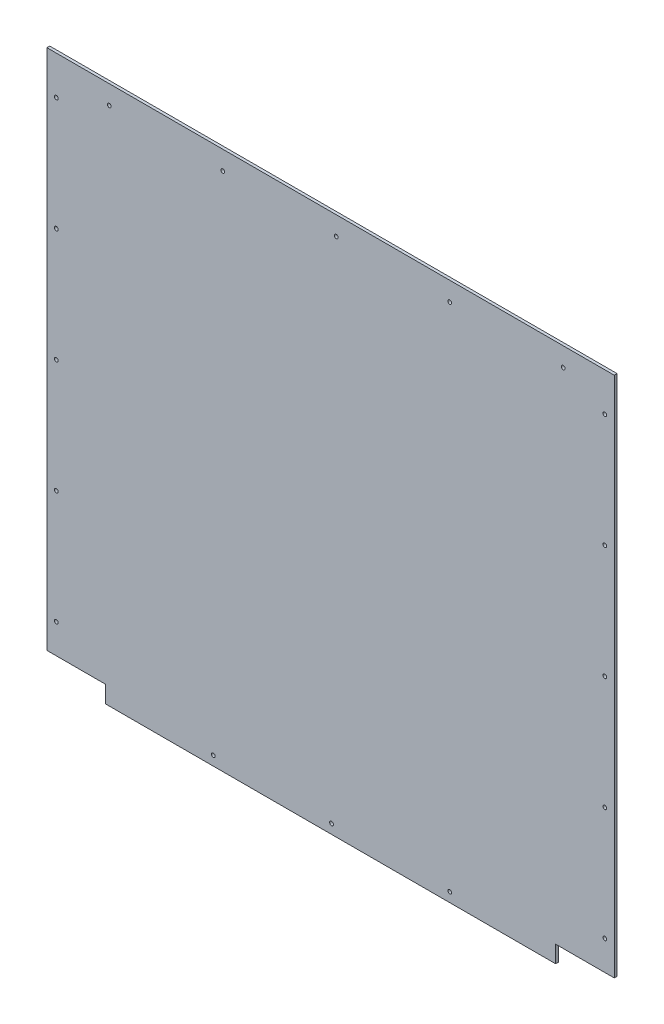
from build123d import *

# Parameters (mm, degrees)
SKETCH1_W             = 600
SKETCH1_H             = 570
BOSS_EXTRUDE1_DEPTH   = 3
SKETCH2_W             = 62
SKETCH2_H             = 18
CUT_EXTRUDE1_DEPTH    = 3
F_4_0MM_DOWEL_HOLE1_D = 4


with BuildPart() as part:
    # Sketch1 → Boss-Extrude1 (new body)
    with BuildSketch(Plane.XY):
        with Locations((300, 285)):
            Rectangle(SKETCH1_W, SKETCH1_H)
    extrude(amount=BOSS_EXTRUDE1_DEPTH)

    # Sketch2 → Cut-Extrude1 (cut)
    with BuildSketch(Plane.XY.offset(3)):
        with Locations((31, 9)):
            Rectangle(SKETCH2_W, SKETCH2_H)
        with Locations((569, 9)):
            Rectangle(SKETCH2_W, SKETCH2_H)
    extrude(amount=-CUT_EXTRUDE1_DEPTH, mode=Mode.SUBTRACT)

    # Ø4.0mm Dowel Hole1 (through all)
    with Locations(Plane(origin=(0, 0, 0), x_dir=(-1, 0, 0), z_dir=(0, 0, -1))):
        with Locations((-546, 550), (-590, 529.25), (-426, 10), (-426, 550), (-306, 550), (-186, 550), (-66, 550), (-10, 529.25), (-10, 409.25), (-10, 289.25), (-10, 169.25), (-10, 49.25), (-590, 409.25), (-590, 289.25), (-590, 169.25), (-590, 49.25), (-301, 10), (-176, 10)):
            Hole(F_4_0MM_DOWEL_HOLE1_D / 2)


solid = part.part
